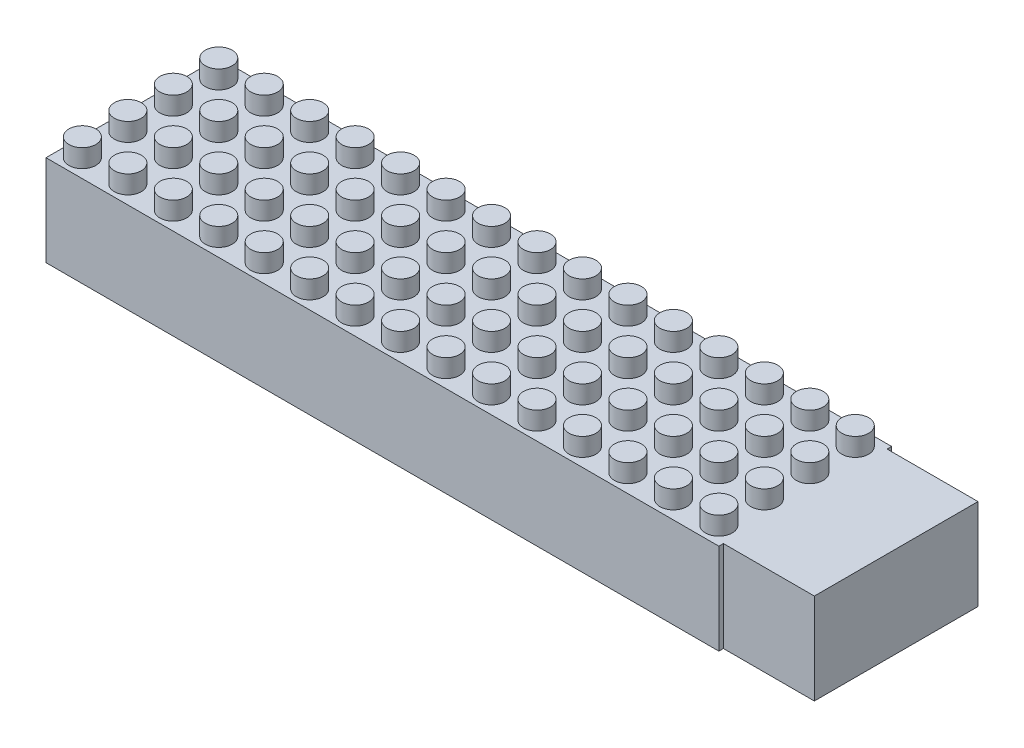
from build123d import *

# Parameters (mm, degrees)
SKETCH_1_W      = 740
SKETCH_1_H      = 190
EXTRUDE_1_DEPTH = 100
SKETCH_2_R      = 14.812408038
EXTRUDE_2_DEPTH = 20
SKETCH_3_W      = 180
SKETCH_3_H      = 100
EXTRUDE_3_DEPTH = 100


with BuildPart() as part:
    # 草图1 → 凸台-拉伸1 (new body)
    with BuildSketch(Plane(origin=(0, 0, 0), x_dir=(1, 0, 0), z_dir=(0, 1, 0))):
        Rectangle(SKETCH_1_W, SKETCH_1_H)
    extrude(amount=EXTRUDE_1_DEPTH)

    # 草图2 → 凸台-拉伸2 (add)
    with BuildSketch(Plane(origin=(0, 100, 0), x_dir=(1, 0, 0), z_dir=(0, 1, 0))):
        with Locations(Location((350, -75, 0), (0, 0, 270))):
            Circle(SKETCH_2_R)
        with Locations(Location((300, -75, 0), (0, 0, 270))):
            Circle(SKETCH_2_R)
        with Locations(Location((250, -75, 0), (0, 0, 270))):
            Circle(SKETCH_2_R)
        with Locations(Location((200, -75, 0), (0, 0, 270))):
            Circle(SKETCH_2_R)
        with Locations(Location((150, -75, 0), (0, 0, 270))):
            Circle(SKETCH_2_R)
        with Locations(Location((100, -75, 0), (0, 0, 270))):
            Circle(SKETCH_2_R)
        with Locations(Location((50, -75, 0), (0, 0, 270))):
            Circle(SKETCH_2_R)
        with Locations(Location((0, -75, 0), (0, 0, 270))):
            Circle(SKETCH_2_R)
        with Locations(Location((-50, -75, 0), (0, 0, 270))):
            Circle(SKETCH_2_R)
        with Locations(Location((-100, -75, 0), (0, 0, 270))):
            Circle(SKETCH_2_R)
        with Locations(Location((-150, -75, 0), (0, 0, 270))):
            Circle(SKETCH_2_R)
        with Locations(Location((-200, -75, 0), (0, 0, 270))):
            Circle(SKETCH_2_R)
        with Locations(Location((-250, -75, 0), (0, 0, 270))):
            Circle(SKETCH_2_R)
        with Locations(Location((-300, -75, 0), (0, 0, 270))):
            Circle(SKETCH_2_R)
        with Locations(Location((-350, -75, 0), (0, 0, 270))):
            Circle(SKETCH_2_R)
        with Locations(Location((300, -25, 0), (0, 0, 270))):
            Circle(SKETCH_2_R)
        with Locations(Location((250, -25, 0), (0, 0, 270))):
            Circle(SKETCH_2_R)
        with Locations(Location((200, -25, 0), (0, 0, 270))):
            Circle(SKETCH_2_R)
        with Locations(Location((150, -25, 0), (0, 0, 270))):
            Circle(SKETCH_2_R)
        with Locations(Location((100, -25, 0), (0, 0, 270))):
            Circle(SKETCH_2_R)
        with Locations(Location((50, -25, 0), (0, 0, 270))):
            Circle(SKETCH_2_R)
        with Locations(Location((0, -25, 0), (0, 0, 270))):
            Circle(SKETCH_2_R)
        with Locations(Location((-50, -25, 0), (0, 0, 270))):
            Circle(SKETCH_2_R)
        with Locations(Location((-100, -25, 0), (0, 0, 270))):
            Circle(SKETCH_2_R)
        with Locations(Location((-150, -25, 0), (0, 0, 270))):
            Circle(SKETCH_2_R)
        with Locations(Location((-200, -25, 0), (0, 0, 270))):
            Circle(SKETCH_2_R)
        with Locations(Location((-250, -25, 0), (0, 0, 270))):
            Circle(SKETCH_2_R)
        with Locations(Location((-300, -25, 0), (0, 0, 270))):
            Circle(SKETCH_2_R)
        with Locations(Location((-350, -25, 0), (0, 0, 270))):
            Circle(SKETCH_2_R)
        with Locations(Location((300, 25, 0), (0, 0, 270))):
            Circle(SKETCH_2_R)
        with Locations(Location((250, 25, 0), (0, 0, 270))):
            Circle(SKETCH_2_R)
        with Locations(Location((200, 25, 0), (0, 0, 270))):
            Circle(SKETCH_2_R)
        with Locations(Location((150, 25, 0), (0, 0, 270))):
            Circle(SKETCH_2_R)
        with Locations(Location((100, 25, 0), (0, 0, 270))):
            Circle(SKETCH_2_R)
        with Locations(Location((50, 25, 0), (0, 0, 270))):
            Circle(SKETCH_2_R)
        with Locations(Location((0, 25, 0), (0, 0, 270))):
            Circle(SKETCH_2_R)
        with Locations(Location((-50, 25, 0), (0, 0, 270))):
            Circle(SKETCH_2_R)
        with Locations(Location((-100, 25, 0), (0, 0, 270))):
            Circle(SKETCH_2_R)
        with Locations(Location((-150, 25, 0), (0, 0, 270))):
            Circle(SKETCH_2_R)
        with Locations(Location((-200, 25, 0), (0, 0, 270))):
            Circle(SKETCH_2_R)
        with Locations(Location((-250, 25, 0), (0, 0, 270))):
            Circle(SKETCH_2_R)
        with Locations(Location((-300, 25, 0), (0, 0, 270))):
            Circle(SKETCH_2_R)
        with Locations(Location((-350, 25, 0), (0, 0, 270))):
            Circle(SKETCH_2_R)
        with Locations(Location((300, 75, 0), (0, 0, 270))):
            Circle(SKETCH_2_R)
        with Locations(Location((250, 75, 0), (0, 0, 270))):
            Circle(SKETCH_2_R)
        with Locations(Location((200, 75, 0), (0, 0, 270))):
            Circle(SKETCH_2_R)
        with Locations(Location((150, 75, 0), (0, 0, 270))):
            Circle(SKETCH_2_R)
        with Locations(Location((100, 75, 0), (0, 0, 270))):
            Circle(SKETCH_2_R)
        with Locations(Location((50, 75, 0), (0, 0, 270))):
            Circle(SKETCH_2_R)
        with Locations(Location((0, 75, 0), (0, 0, 270))):
            Circle(SKETCH_2_R)
        with Locations(Location((-50, 75, 0), (0, 0, 270))):
            Circle(SKETCH_2_R)
        with Locations(Location((-100, 75, 0), (0, 0, 270))):
            Circle(SKETCH_2_R)
        with Locations(Location((-150, 75, 0), (0, 0, 270))):
            Circle(SKETCH_2_R)
        with Locations(Location((-200, 75, 0), (0, 0, 270))):
            Circle(SKETCH_2_R)
        with Locations(Location((-250, 75, 0), (0, 0, 270))):
            Circle(SKETCH_2_R)
        with Locations(Location((-300, 75, 0), (0, 0, 270))):
            Circle(SKETCH_2_R)
        with Locations(Location((-350, 75, 0), (0, 0, 270))):
            Circle(SKETCH_2_R)
        with Locations(Location((350, -25, 0), (0, 0, 270))):
            Circle(SKETCH_2_R)
        with Locations(Location((350, 25, 0), (0, 0, 270))):
            Circle(SKETCH_2_R)
        with Locations(Location((350, 75, 0), (0, 0, 270))):
            Circle(SKETCH_2_R)
    extrude(amount=EXTRUDE_2_DEPTH)

    # 草图3 → 凸台-拉伸3 (add)
    with BuildSketch(Plane(origin=(370, 0, 0), x_dir=(0, 0, -1), z_dir=(1, 0, 0))):
        with Locations((0, 50)):
            Rectangle(SKETCH_3_W, SKETCH_3_H)
    extrude(amount=EXTRUDE_3_DEPTH)


solid = part.part
